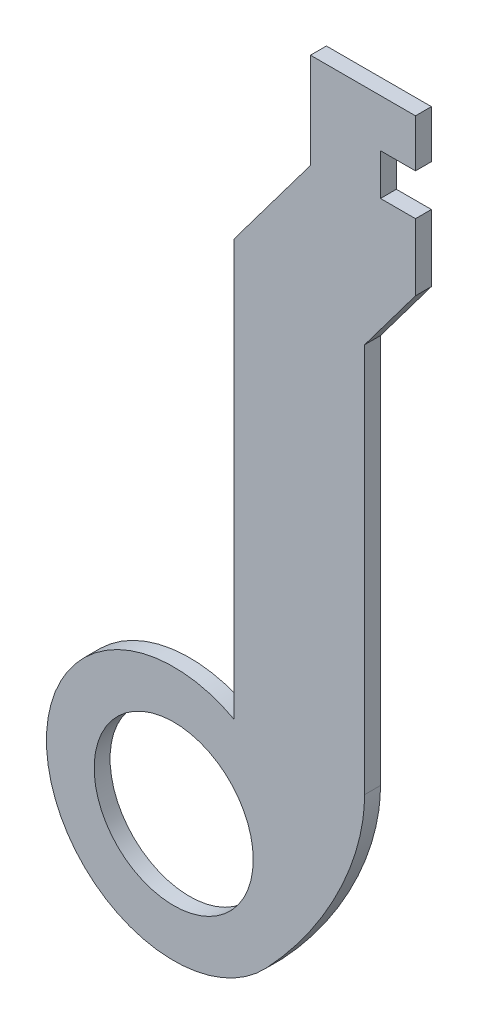
from build123d import *

# Parameters (mm, degrees)
SALIENTE_EXTRUIR1_DEPTH = 0.5
CORTAR_EXTRUIR6_REACH   = 31.207
CROQUIS6_R              = 2.5


with BuildPart() as part:
    # Croquis1 → Saliente-Extruir1 (new body)
    with BuildSketch(Plane.XY):
        with BuildLine():
            Line((0, 0), (0, -1.5))
            Line((0, -1.5), (-1.1, -1.5))
            Line((-1.1, -1.5), (-1.1, -2.8))
            Line((-1.1, -2.8), (0, -2.8))
            Line((0, -2.8), (0, -4.9))
            Line((0, -4.9), (-1.6, -7.033333333))
            Line((-1.6, -7.033333333), (-1.6, -19.280056819))
            add(Edge.make_bspline(
                [(-4.695633314, -25.550391636), (-1.6, -22.281455624), (-1.6, -19.280056819)],
                knots=[4.71238898, 4.71238898, 4.71238898, 5.777895429, 5.777895429, 5.777895429], degree=2, weights=[1, 0.861411956, 1]))
            ThreePointArc((-4.695633314, -25.550391636), (-11.549653085, -23.432645639), (-5.7, -19.280056819))
            Line((-5.7, -19.280056819), (-5.7, -6.2))
            Line((-5.7, -6.2), (-3.3, -3))
            Line((-3.3, -3), (-3.3, 0))
            Line((-3.3, 0), (0, 0))
        make_face()
    extrude(amount=SALIENTE_EXTRUIR1_DEPTH)

    # Croquis6 → Cortar-Extruir6 (cut, up to next)
    with BuildSketch(Plane.XY.offset(0.5), mode=Mode.PRIVATE) as cortar_extruir6_sk1:
        with Locations((-7.6, -22.8)):
            Circle(CROQUIS6_R)
    cortar_extruir6_tool1 = extrude(cortar_extruir6_sk1.sketch, amount=-CORTAR_EXTRUIR6_REACH, mode=Mode.PRIVATE) & part.part
    add(cortar_extruir6_tool1.solids().sort_by_distance((-7.6, -22.8, 0.5))[0], mode=Mode.SUBTRACT)


solid = part.part
